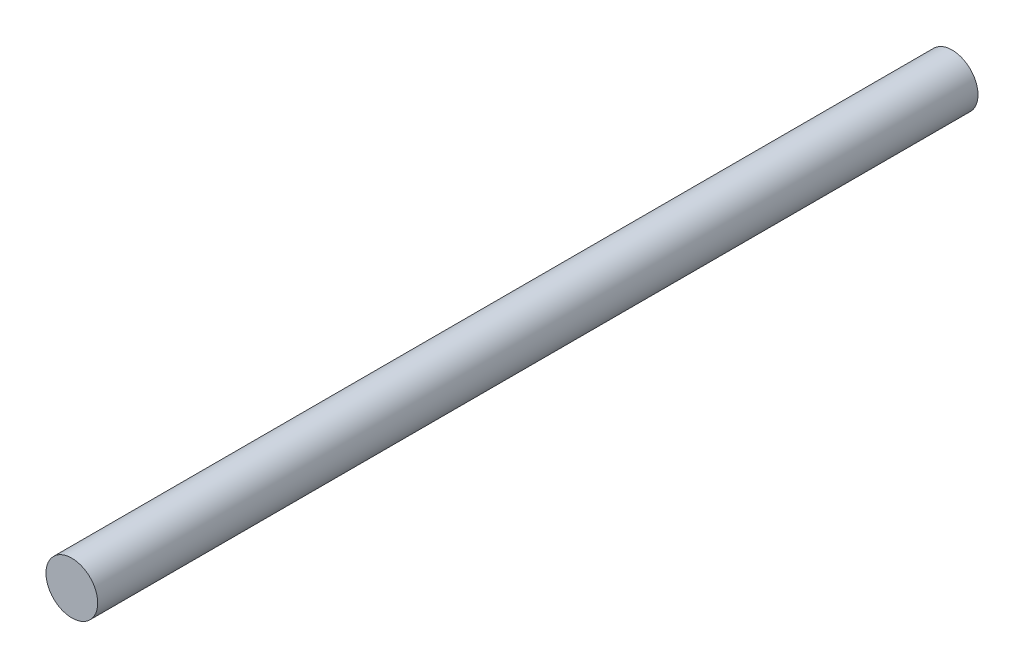
from build123d import *

# Parameters (mm, degrees)
SKETCH_1_R      = 2.5
EXTRUDE_1_DEPTH = 85


with BuildPart() as part:
    # 草图1 → 凸台-拉伸1 (new body)
    with BuildSketch(Plane.XY):
        Circle(SKETCH_1_R)
    extrude(amount=EXTRUDE_1_DEPTH)


solid = part.part
